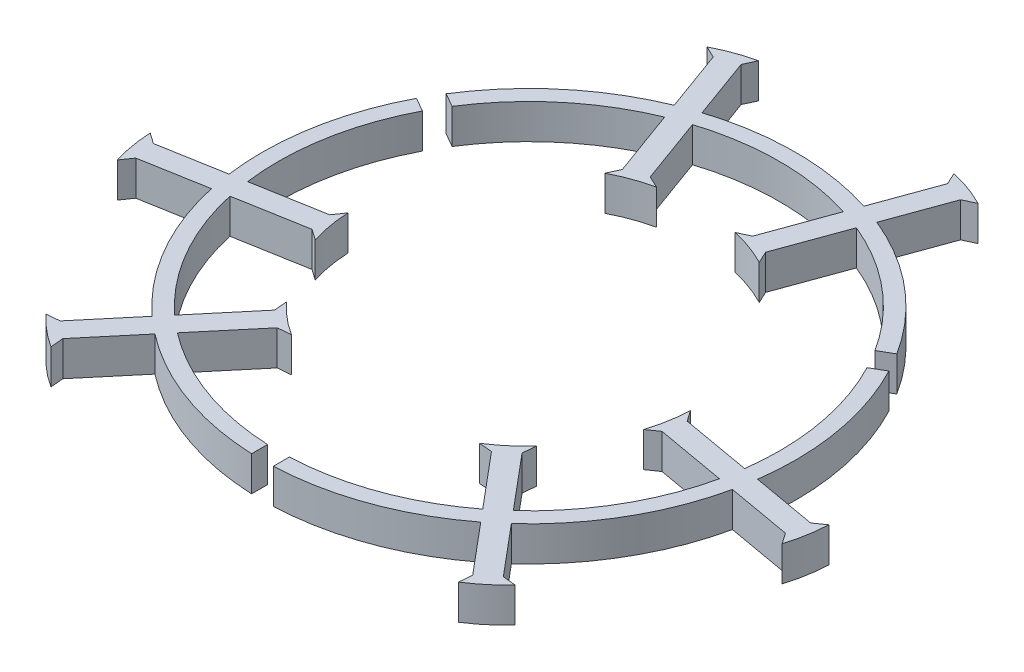
from build123d import *

# Parameters (mm, degrees)
BOSS_EXTRUDE1_DEPTH   = 3.265
BOSS_EXTRUDE1_2_DEPTH = 3.265
BOSS_EXTRUDE1_3_DEPTH = 3.265


with BuildPart() as part:
    # Sketch1 → Boss-Extrude1 (new body)
    with BuildSketch(Plane(origin=(0, 0, 0), x_dir=(1, 0, 0), z_dir=(0, 1, 0))):
        with BuildLine():
            Line((-6.724046162, 15.491884508), (-7.243917376, 14.377017092))
            ThreePointArc((-7.243917376, 14.377017092), (-5.510136615, 15.138975927), (-3.692205799, 15.669734386))
            Line((-3.692205799, 15.669734386), (-4.807073215, 16.189605601))
            Line((-4.807073215, 16.189605601), (-7.08168258, 22.43904347))
            ThreePointArc((-7.08168258, 22.43904347), (0, 23.53), (7.08168258, 22.43904347))
            Line((7.08168258, 22.43904347), (4.807073215, 16.189605601))
            Line((4.807073215, 16.189605601), (3.692205799, 15.669734386))
            ThreePointArc((3.692205799, 15.669734386), (5.510136615, 15.138975927), (7.243917376, 14.377017092))
            Line((7.243917376, 14.377017092), (6.724046162, 15.491884508))
            Line((6.724046162, 15.491884508), (8.998655527, 21.741322377))
            ThreePointArc((8.998655527, 21.741322377), (15.124792456, 18.025025747), (19.848422704, 12.63728674))
            Line((19.848422704, 12.63728674), (21.146442856, 13.386699025))
            ThreePointArc((21.146442856, 13.386699025), (16.087366901, 19.1721773), (9.511283721, 23.149756764))
            Line((9.511283721, 23.149756764), (11.608093808, 28.910695133))
            Line((11.608093808, 28.910695133), (12.722961226, 29.430566348))
            ThreePointArc((12.722961226, 29.430566348), (10.988981231, 30.191977795), (9.171249647, 30.723283643))
            Line((9.171249647, 30.723283643), (9.691120862, 29.608416225))
            Line((9.691120862, 29.608416225), (7.594310774, 23.847477856))
            ThreePointArc((7.594310774, 23.847477856), (0, 25.0275), (-7.594310774, 23.847477856))
            Line((-7.594310774, 23.847477856), (-9.691120862, 29.608416225))
            Line((-9.691120862, 29.608416225), (-9.171249647, 30.723283643))
            ThreePointArc((-9.171249647, 30.723283643), (-10.988981231, 30.191977795), (-12.722961226, 29.430566348))
            Line((-12.722961226, 29.430566348), (-11.608093808, 28.910695133))
            Line((-11.608093808, 28.910695133), (-9.511283721, 23.149756764))
            ThreePointArc((-9.511283721, 23.149756764), (-16.087366901, 19.1721773), (-21.146442856, 13.386699025))
            Line((-21.146442856, 13.386699025), (-19.848422704, 12.63728674))
            ThreePointArc((-19.848422704, 12.63728674), (-15.124792456, 18.025025747), (-8.998655527, 21.741322377))
            Line((-8.998655527, 21.741322377), (-6.724046162, 15.491884508))
        make_face()
    extrude(amount=BOSS_EXTRUDE1_DEPTH)


with BuildPart() as body_2:
    # Sketch1 → Boss-Extrude1 2 (new body)
    with BuildSketch(Plane(origin=(0, 0, 0), x_dir=(1, 0, 0), z_dir=(0, 1, 0))):
        with BuildLine():
            Line((16.778388617, -1.922747462), (16.07282072, -0.915092075))
            ThreePointArc((16.07282072, -0.915092075), (15.865806048, -2.797569677), (15.416490948, -4.637323176))
            Line((15.416490948, -4.637323176), (16.424146335, -3.931755278))
            Line((16.424146335, -3.931755278), (22.973622971, -5.086604719))
            ThreePointArc((22.973622971, -5.086604719), (20.377577751, -11.765), (15.891940391, -17.352438751))
            Line((15.891940391, -17.352438751), (11.61707312, -12.257850322))
            Line((11.61707312, -12.257850322), (11.72428515, -11.032411211))
            ThreePointArc((11.72428515, -11.032411211), (10.355669433, -12.34140625), (8.828903344, -13.461925016))
            Line((8.828903344, -13.461925016), (10.054342456, -13.569137046))
            Line((10.054342456, -13.569137046), (14.329209727, -18.663725475))
            ThreePointArc((14.329209727, -18.663725475), (8.047733972, -22.110967367), (1.02, -23.507881657))
            Line((1.02, -23.507881657), (1.02, -25.006706226))
            ThreePointArc((1.02, -25.006706226), (8.559909137, -23.518157067), (15.292635589, -19.811891707))
            Line((15.292635589, -19.811891707), (19.233349522, -24.508251694))
            Line((19.233349522, -24.508251694), (19.126137492, -25.733690807))
            ThreePointArc((19.126137492, -25.733690807), (20.652529145, -24.612725805), (22.021519299, -23.304177))
            Line((22.021519299, -23.304177), (20.796080186, -23.19696497))
            Line((20.796080186, -23.19696497), (16.855366253, -18.500604983))
            ThreePointArc((16.855366253, -18.500604983), (21.674450793, -12.51375), (24.449677027, -5.346872874))
            Line((24.449677027, -5.346872874), (30.487201048, -6.411451255))
            Line((30.487201048, -6.411451255), (31.192768946, -7.419106643))
            ThreePointArc((31.192768946, -7.419106643), (31.641510376, -5.57925199), (31.849098718, -3.696875541))
            Line((31.849098718, -3.696875541), (30.84144333, -4.402443439))
            Line((30.84144333, -4.402443439), (24.803919309, -3.337865057))
            ThreePointArc((24.803919309, -3.337865057), (24.647276039, 4.345979767), (22.166442856, 11.620007201))
            Line((22.166442856, 11.620007201), (20.868422704, 10.870594917))
            ThreePointArc((20.868422704, 10.870594917), (23.172526428, 4.085941621), (23.327865254, -3.077596902))
            Line((23.327865254, -3.077596902), (16.778388617, -1.922747462))
        make_face()
    extrude(amount=BOSS_EXTRUDE1_2_DEPTH)


with BuildPart() as body_3:
    # Sketch1 → Boss-Extrude1 3 (new body)
    with BuildSketch(Plane(origin=(0, 0, 0), x_dir=(1, 0, 0), z_dir=(0, 1, 0))):
        with BuildLine():
            Line((-10.054342456, -13.569137046), (-8.828903344, -13.461925016))
            ThreePointArc((-8.828903344, -13.461925016), (-10.355669433, -12.34140625), (-11.72428515, -11.032411211))
            Line((-11.72428515, -11.032411211), (-11.61707312, -12.257850322))
            Line((-11.61707312, -12.257850322), (-15.891940391, -17.352438751))
            ThreePointArc((-15.891940391, -17.352438751), (-20.377577751, -11.765), (-22.973622971, -5.086604719))
            Line((-22.973622971, -5.086604719), (-16.424146335, -3.931755278))
            Line((-16.424146335, -3.931755278), (-15.416490948, -4.637323176))
            ThreePointArc((-15.416490948, -4.637323176), (-15.865806048, -2.797569677), (-16.07282072, -0.915092075))
            Line((-16.07282072, -0.915092075), (-16.778388617, -1.922747462))
            Line((-16.778388617, -1.922747462), (-23.327865254, -3.077596902))
            ThreePointArc((-23.327865254, -3.077596902), (-23.172526428, 4.085941621), (-20.868422704, 10.870594917))
            Line((-20.868422704, 10.870594917), (-22.166442856, 11.620007201))
            ThreePointArc((-22.166442856, 11.620007201), (-24.647276039, 4.345979767), (-24.803919309, -3.337865057))
            Line((-24.803919309, -3.337865057), (-30.84144333, -4.402443439))
            Line((-30.84144333, -4.402443439), (-31.849098718, -3.696875541))
            ThreePointArc((-31.849098718, -3.696875541), (-31.641510376, -5.57925199), (-31.192768946, -7.419106643))
            Line((-31.192768946, -7.419106643), (-30.487201048, -6.411451255))
            Line((-30.487201048, -6.411451255), (-24.449677027, -5.346872874))
            ThreePointArc((-24.449677027, -5.346872874), (-21.674450793, -12.51375), (-16.855366253, -18.500604983))
            Line((-16.855366253, -18.500604983), (-20.796080186, -23.19696497))
            Line((-20.796080186, -23.19696497), (-22.021519299, -23.304177))
            ThreePointArc((-22.021519299, -23.304177), (-20.652529145, -24.612725805), (-19.126137492, -25.733690807))
            Line((-19.126137492, -25.733690807), (-19.233349522, -24.508251694))
            Line((-19.233349522, -24.508251694), (-15.292635589, -19.811891707))
            ThreePointArc((-15.292635589, -19.811891707), (-8.559909137, -23.518157067), (-1.02, -25.006706226))
            Line((-1.02, -25.006706226), (-1.02, -23.507881657))
            ThreePointArc((-1.02, -23.507881657), (-8.047733972, -22.110967367), (-14.329209727, -18.663725475))
            Line((-14.329209727, -18.663725475), (-10.054342456, -13.569137046))
        make_face()
    extrude(amount=BOSS_EXTRUDE1_3_DEPTH)


solid = Compound([part.part, body_2.part, body_3.part])
